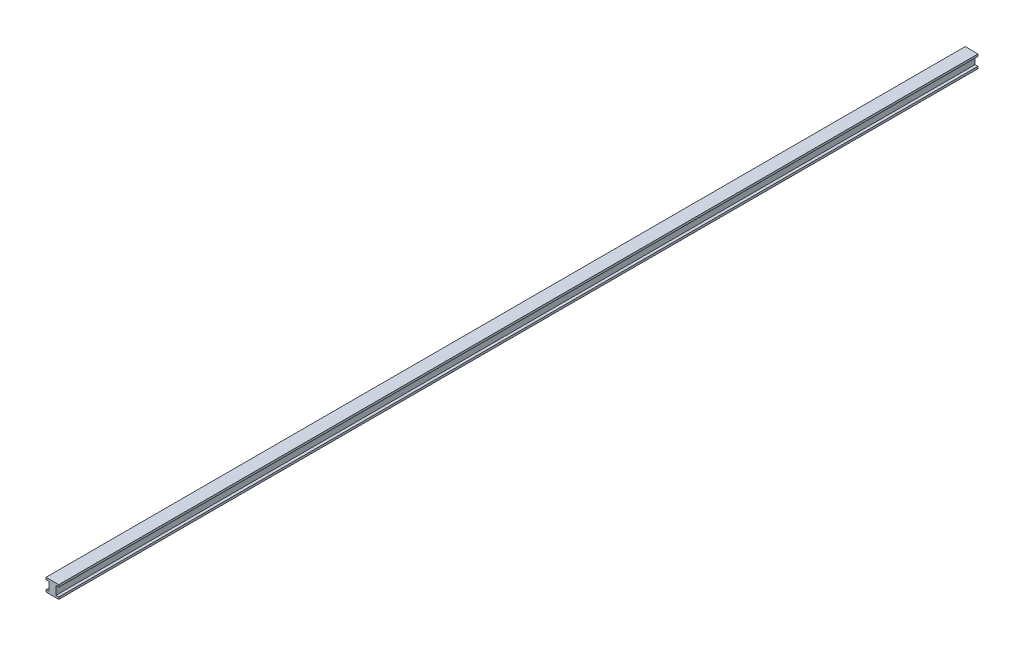
from build123d import *

# Parameters (mm, degrees)
BOSS_EXTRUDE1_DEPTH = 646.904


with BuildPart() as part:
    # Sketch1 → Boss-Extrude1 (new body)
    with BuildSketch(Plane.XY):
        Polygon((-5, -6), (-5, 6), (-9, 6), (-9, 9), (9, 9), (9, 6), (5, 6), (5, -6), (9, -6), (9, -9), (-9, -9), (-9, -6), align=None)
    extrude(amount=BOSS_EXTRUDE1_DEPTH)

    # Mirror1: part across plane


with BuildPart() as part_1:
    add(part.part)
    add(part.part.mirror(Plane(origin=(0, 0, 0), x_dir=(1, 0, 0), z_dir=(0, 0, -1))))


solid = part_1.part
